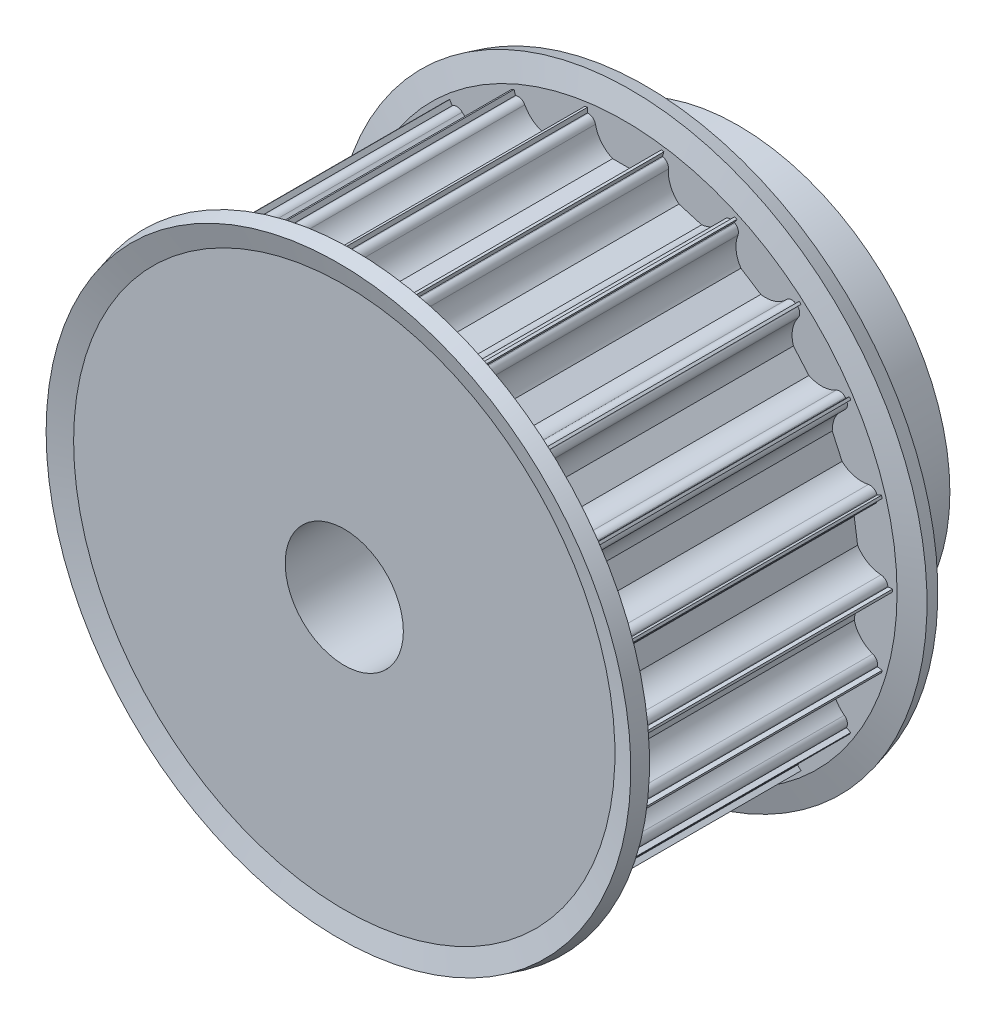
from build123d import *

# Parameters (mm, degrees)
CUT_EXTRUDE1_REACH = 57.544
CIRPATTERN1_COUNT  = 22


with BuildPart() as part:
    # Sketch1 → Revolve1 (revolve)
    with BuildSketch(Plane(origin=(0, 0, 0), x_dir=(0, 0, -1), z_dir=(1, 0, 0)), mode=Mode.PRIVATE) as revolve1_sk:
        Polygon((0, 6), (40, 6), (40, 21.5), (30, 21.5), (30, 27.25), (0, 27.25), align=None)
    revolve(revolve1_sk.sketch.rotate(Axis((0, 0, 0), (0, 0, -1)), 90), axis=Axis((0, 0, 0), (0, 0, -1)))

    # Sketch2 → Cut-Extrude1 (cut, up to next)
    with BuildSketch(Plane.XY, mode=Mode.PRIVATE) as cut_extrude1_sk1:
        with BuildLine():
            Line((-3.674234614, 26.5), (-3.75, 26.5))
            Line((-3.75, 26.5), (-3.75, 28.5))
            Line((-3.75, 28.5), (3.75, 28.5))
            Line((3.75, 28.5), (3.75, 26.5))
            Line((3.75, 26.5), (3.674234614, 26.5))
            ThreePointArc((3.674234614, 26.5), (3.199892965, 26.330947502), (2.939387691, 25.9))
            ThreePointArc((2.939387691, 25.9), (2.331759211, 24.612435701), (1.198957881, 23.75))
            Line((1.198957881, 23.75), (-1.198957881, 23.75))
            ThreePointArc((-1.198957881, 23.75), (-2.331759211, 24.612435701), (-2.939387691, 25.9))
            ThreePointArc((-2.939387691, 25.9), (-3.199892965, 26.330947502), (-3.674234614, 26.5))
        make_face()
    cut_extrude1_tool1 = extrude(cut_extrude1_sk1.sketch, amount=-CUT_EXTRUDE1_REACH, mode=Mode.PRIVATE) & part.part
    cut_extrude1 = cut_extrude1_tool1.solids().sort_by_distance((0, 26.435169, 0))[0]
    add(cut_extrude1, mode=Mode.SUBTRACT)

    # CirPattern1: Cut-Extrude1 ×22 about axis
    cirpattern1_axis = Axis((0, 0, 0), (0, 0, 1))
    for i in range(1, CIRPATTERN1_COUNT):
        add(cut_extrude1.rotate(cirpattern1_axis, i * 360 / CIRPATTERN1_COUNT), mode=Mode.SUBTRACT)

    # Sketch3 → Revolve3 (revolve)
    with BuildSketch(Plane(origin=(0, 0, 0), x_dir=(0, 0, -1), z_dir=(1, 0, 0)), mode=Mode.PRIVATE) as revolve3_sk:
        Polygon((30, 21.5), (30, 27.485554958), (30.590163791, 29.688076211), (29.090163791, 30.09), (28.447085729, 27.69), (28.447085729, 21.5), align=None)
        Polygon((1.552914271, 21.5), (0, 21.5), (0, 27.485554958), (-0.590163791, 29.688076211), (0.909836209, 30.09), (1.552914271, 27.69), align=None)
    revolve(revolve3_sk.sketch.rotate(Axis((0, 0, 0), (0, 0, 1)), 90), axis=Axis((0, 0, 0), (0, 0, 1)))


solid = part.part
